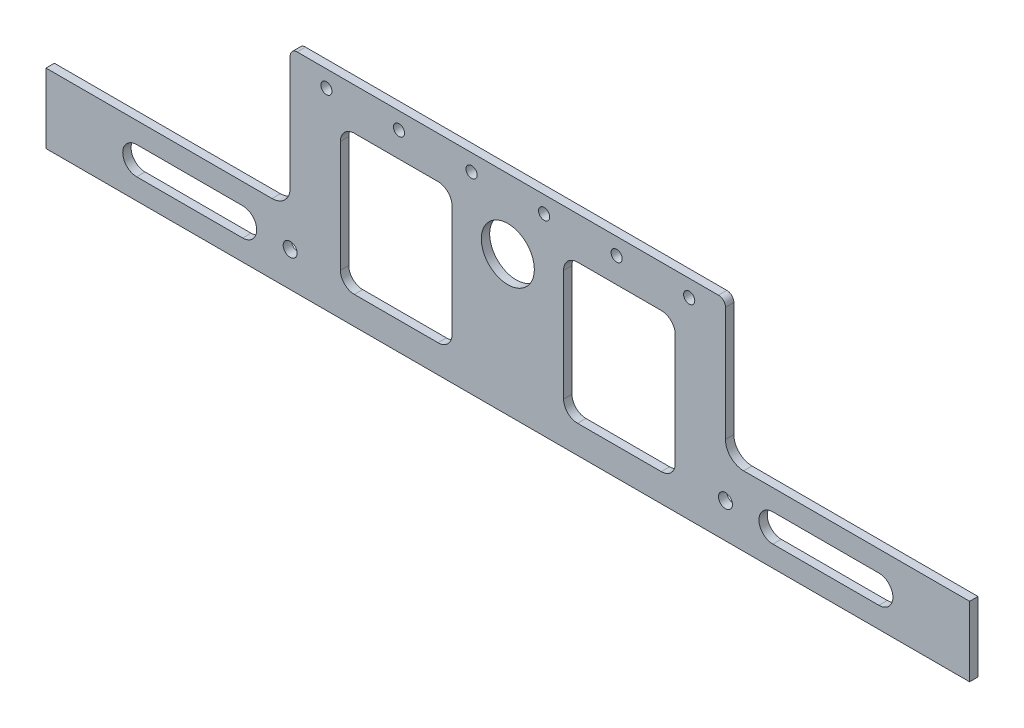
from build123d import *

# Parameters (mm, degrees)
SKETCH1_R           = 9.5
SKETCH1_R_2         = 2
SKETCH1_R_3         = 2.5
BOSS_EXTRUDE1_DEPTH = 1.5


with BuildPart() as part:
    # Sketch1 → Boss-Extrude1 (new, symmetric)
    with BuildSketch(Plane.XY):
        with BuildLine():
            Line((165.5, 0), (165.5, 25))
            Line((165.5, 25), (84.5, 25))
            ThreePointArc((84.5, 25), (79.903805922, 26.903805922), (78, 31.5))
            Line((78, 31.5), (78, 72.5))
            ThreePointArc((78, 72.5), (77.267766953, 74.267766953), (75.5, 75))
            Line((75.5, 75), (-75.5, 75))
            ThreePointArc((-75.5, 75), (-77.267766953, 74.267766953), (-78, 72.5))
            Line((-78, 72.5), (-78, 31.5))
            ThreePointArc((-78, 31.5), (-79.903805922, 26.903805922), (-84.5, 25))
            Line((-84.5, 25), (-165.5, 25))
            Line((-165.5, 25), (-165.5, 0))
            Line((-165.5, 0), (165.5, 0))
        make_face()
        with Locations((0, 50)):
            Circle(SKETCH1_R, mode=Mode.SUBTRACT)
        with Locations((-65, 69)):
            Circle(SKETCH1_R_2, mode=Mode.SUBTRACT)
        with Locations((-39, 69)):
            Circle(SKETCH1_R_2, mode=Mode.SUBTRACT)
        with Locations((-13, 69)):
            Circle(SKETCH1_R_2, mode=Mode.SUBTRACT)
        with Locations((13, 69)):
            Circle(SKETCH1_R_2, mode=Mode.SUBTRACT)
        with Locations((39, 69)):
            Circle(SKETCH1_R_2, mode=Mode.SUBTRACT)
        with Locations((65, 69)):
            Circle(SKETCH1_R_2, mode=Mode.SUBTRACT)
        with Locations((-78, 12.5)):
            Circle(SKETCH1_R_3, mode=Mode.SUBTRACT)
        with Locations((78, 12.5)):
            Circle(SKETCH1_R_3, mode=Mode.SUBTRACT)
        with BuildLine():
            Line((-55, 60), (-25, 60))
            ThreePointArc((-25, 60), (-21.464466094, 58.535533906), (-20, 55))
            Line((-20, 55), (-20, 15))
            ThreePointArc((-20, 15), (-21.464466094, 11.464466094), (-25, 10))
            Line((-25, 10), (-55, 10))
            ThreePointArc((-55, 10), (-58.535533906, 11.464466094), (-60, 15))
            Line((-60, 15), (-60, 55))
            ThreePointArc((-60, 55), (-58.535533906, 58.535533906), (-55, 60))
        make_face(mode=Mode.SUBTRACT)
        with BuildLine():
            Line((-133, 17.5), (-95, 17.5))
            ThreePointArc((-95, 17.5), (-90, 12.5), (-95, 7.5))
            Line((-95, 7.5), (-133, 7.5))
            ThreePointArc((-133, 7.5), (-138, 12.5), (-133, 17.5))
        make_face(mode=Mode.SUBTRACT)
        with BuildLine():
            Line((133, 17.5), (95, 17.5))
            ThreePointArc((95, 17.5), (90, 12.5), (95, 7.5))
            Line((95, 7.5), (133, 7.5))
            ThreePointArc((133, 7.5), (138, 12.5), (133, 17.5))
        make_face(mode=Mode.SUBTRACT)
        with BuildLine():
            Line((55, 10), (25, 10))
            ThreePointArc((25, 10), (21.464466094, 11.464466094), (20, 15))
            Line((20, 15), (20, 55))
            ThreePointArc((20, 55), (21.464466094, 58.535533906), (25, 60))
            Line((25, 60), (55, 60))
            ThreePointArc((55, 60), (58.535533906, 58.535533906), (60, 55))
            Line((60, 55), (60, 15))
            ThreePointArc((60, 15), (58.535533906, 11.464466094), (55, 10))
        make_face(mode=Mode.SUBTRACT)
    extrude(amount=BOSS_EXTRUDE1_DEPTH, both=True)


solid = part.part
